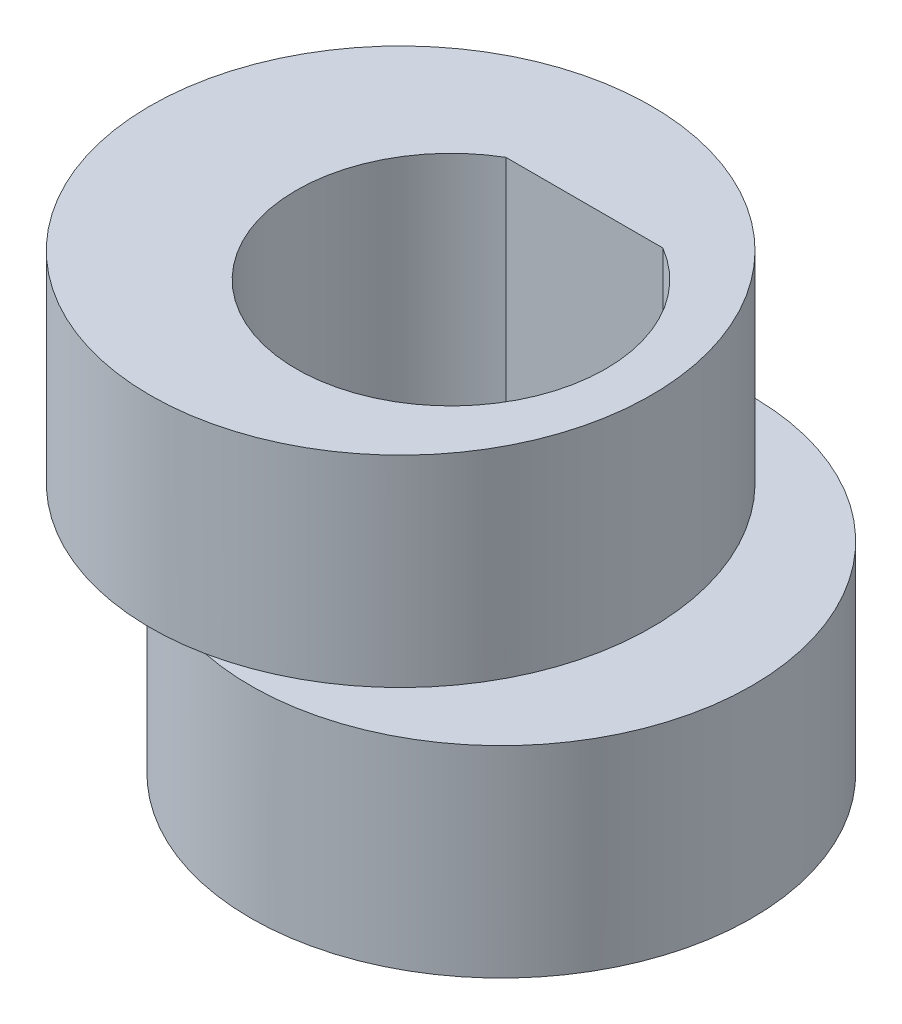
from build123d import *

# Parameters (mm, degrees)
CROQUIS1_R              = 4.98
SALIENTE_EXTRUIR1_DEPTH = 4
CROQUIS2_R              = 4.98
SALIENTE_EXTRUIR2_DEPTH = 4
CORTAR_EXTRUIR1_DEPTH   = 12.160680983


with BuildPart() as part:
    # Croquis1 → Saliente-Extruir1 (new body)
    with BuildSketch(Plane(origin=(0, 0, 0), x_dir=(1, 0, 0), z_dir=(0, 1, 0))):
        with Locations(Location((1, 0, 0), (0, 0, 270))):
            Circle(CROQUIS1_R)
    extrude(amount=SALIENTE_EXTRUIR1_DEPTH)

    # Croquis2 → Saliente-Extruir2 (add)
    with BuildSketch(Plane(origin=(0, 4, 0), x_dir=(1, 0, 0), z_dir=(0, 1, 0))):
        with Locations(Location((-1, 0, 0), (0, 0, 78.416067345))):
            Circle(CROQUIS2_R)
    extrude(amount=SALIENTE_EXTRUIR2_DEPTH)

    # Croquis3 → Cortar-Extruir1 (cut, through all)
    with BuildSketch(Plane(origin=(0, 0, 0), x_dir=(1, 0, 0), z_dir=(0, 1, 0))):
        with BuildLine():
            Line((-1.559847749, 2.65), (1.559847749, 2.65))
            ThreePointArc((1.559847749, 2.65), (0, -3.075), (-1.559847749, 2.65))
        make_face()
    extrude(amount=CORTAR_EXTRUIR1_DEPTH, mode=Mode.SUBTRACT)


solid = part.part
